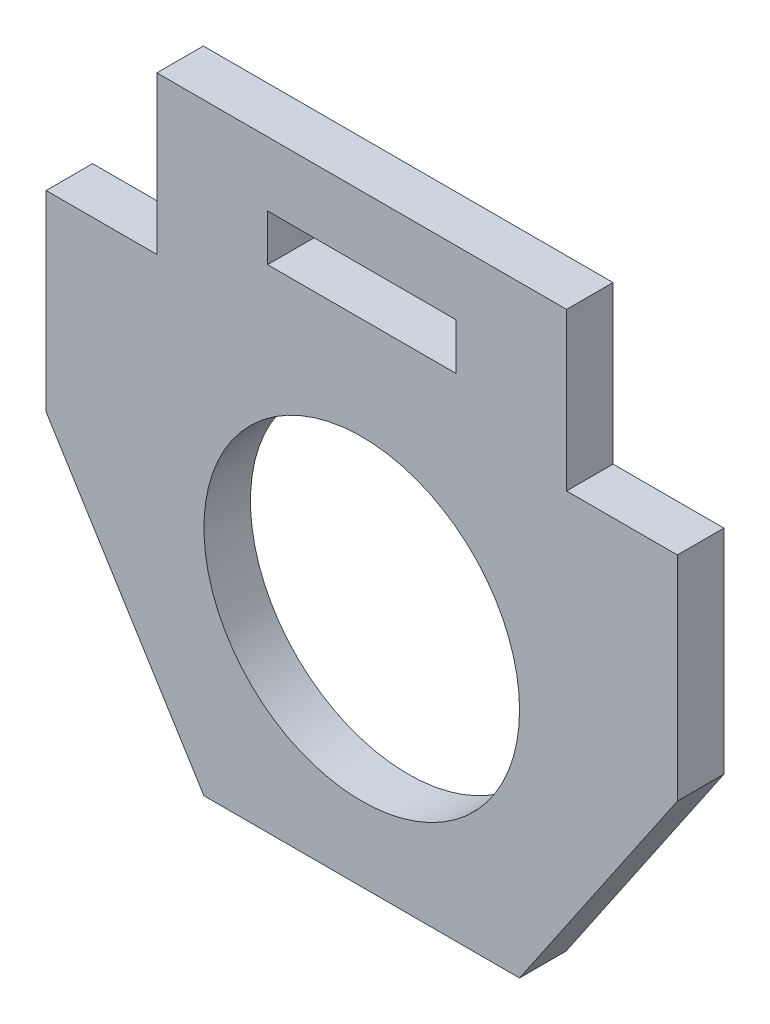
from build123d import *

# Parameters (mm, degrees)
SKETCH1_W           = 21.59
SKETCH1_H           = 5.334
BOSS_EXTRUDE1_DEPTH = 5.334
SKETCH2_R           = 18.1
CUT_EXTRUDE1_DEPTH  = 5.334


with BuildPart() as part:
    # Sketch1 → Boss-Extrude1 (new body)
    with BuildSketch(Plane.XY):
        Polygon((-36.2, 24.449992223), (-23.5, 24.449992223), (-23.5, 42.483992223), (23.49, 42.483992223), (23.49, 24.449992223), (36.2, 24.449992223), (36.2, -7.777e-06), (18.1, -26.619054692), (-18.1, -26.619054692), (-36.2, 2.462571049), align=None)
        with Locations((-0.005, 32.451)):
            Rectangle(SKETCH1_W, SKETCH1_H, mode=Mode.SUBTRACT)
    extrude(amount=BOSS_EXTRUDE1_DEPTH)

    # Sketch2 → Cut-Extrude1 (cut)
    with BuildSketch(Plane.XY.offset(5.334)):
        Circle(SKETCH2_R)
    extrude(amount=-CUT_EXTRUDE1_DEPTH, mode=Mode.SUBTRACT)


solid = part.part
